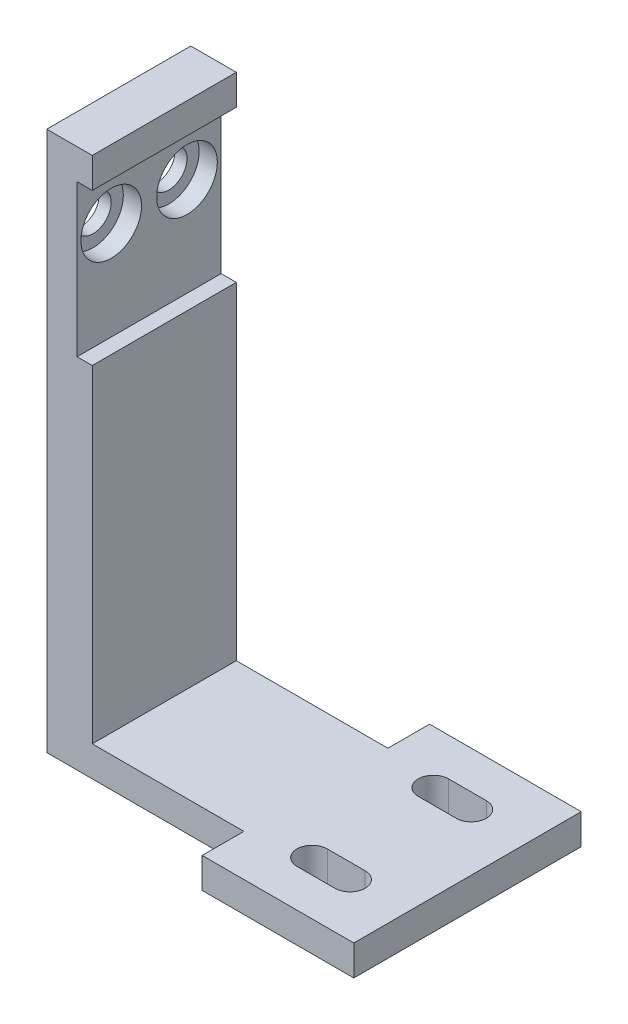
from build123d import *

# Parameters (mm, degrees)
BOSS_EXTRUDE1_DEPTH  = 4.75
M2_CLEARANCE_HOLE1_D = 2.4
SKETCH4_R            = 2
CUT_EXTRUDE1_DEPTH   = 1.2
SKETCH5_W            = 10
SKETCH5_H            = 15
BOSS_EXTRUDE2_DEPTH  = 2
CUT_EXTRUDE2_DEPTH   = 2


with BuildPart() as part:
    # Sketch1 → Boss-Extrude1 (new, symmetric)
    with BuildSketch(Plane.XY):
        Polygon((-17.53737418, 15.5), (-17.53737418, 25.5), (-16.53737418, 25.5), (-16.53737418, 27.5), (-19.53737418, 27.5), (-19.53737418, 0), (-19.53737418, -8.11), (-11.42737418, -8.11), (3.46262582, -8.11), (3.46262582, -6.11), (-12.42737418, -6.11), (-16.53737418, -6.11), (-16.53737418, 12.5), (-16.53737418, 15.5), align=None)
    extrude(amount=BOSS_EXTRUDE1_DEPTH, both=True)

    # M2 Clearance Hole1 (through all)
    with Locations(Plane(origin=(-17.53737418, 22, 2.5), x_dir=(0, 1, 0), z_dir=(1, 0, 0))):
        with Locations((0, 0), (0, -5)):
            Hole(M2_CLEARANCE_HOLE1_D / 2)

    # Sketch4 → Cut-Extrude1 (cut)
    with BuildSketch(Plane(origin=(-17.53737418, 0, 0), x_dir=(0, 0, -1), z_dir=(1, 0, 0))):
        with Locations((-2.5, 22)):
            Circle(SKETCH4_R)
        with Locations((2.5, 22)):
            Circle(SKETCH4_R)
    extrude(amount=-CUT_EXTRUDE1_DEPTH, mode=Mode.SUBTRACT)

    # Sketch5 → Boss-Extrude2 (add)
    with BuildSketch(Plane.XZ.offset(8.11)):
        with Locations((-1.53737418, 0)):
            Rectangle(SKETCH5_W, SKETCH5_H)
    extrude(amount=-BOSS_EXTRUDE2_DEPTH)

    # Sketch6 → Cut-Extrude2 (cut)
    with BuildSketch(Plane(origin=(0, -6.11, 0), x_dir=(1, 0, 0), z_dir=(0, 1, 0))):
        with BuildLine():
            Line((-0.28737418, -5), (-2.78737418, -5))
            ThreePointArc((-2.78737418, -5), (-3.78737418, -4), (-2.78737418, -3))
            Line((-2.78737418, -3), (-0.28737418, -3))
            ThreePointArc((-0.28737418, -3), (0.71262582, -4), (-0.28737418, -5))
        make_face()
        with BuildLine():
            Line((-0.28737418, 5), (-2.78737418, 5))
            ThreePointArc((-2.78737418, 5), (-3.78737418, 4), (-2.78737418, 3))
            Line((-2.78737418, 3), (-0.28737418, 3))
            ThreePointArc((-0.28737418, 3), (0.71262582, 4), (-0.28737418, 5))
        make_face()
    extrude(amount=-CUT_EXTRUDE2_DEPTH, mode=Mode.SUBTRACT)


solid = part.part
